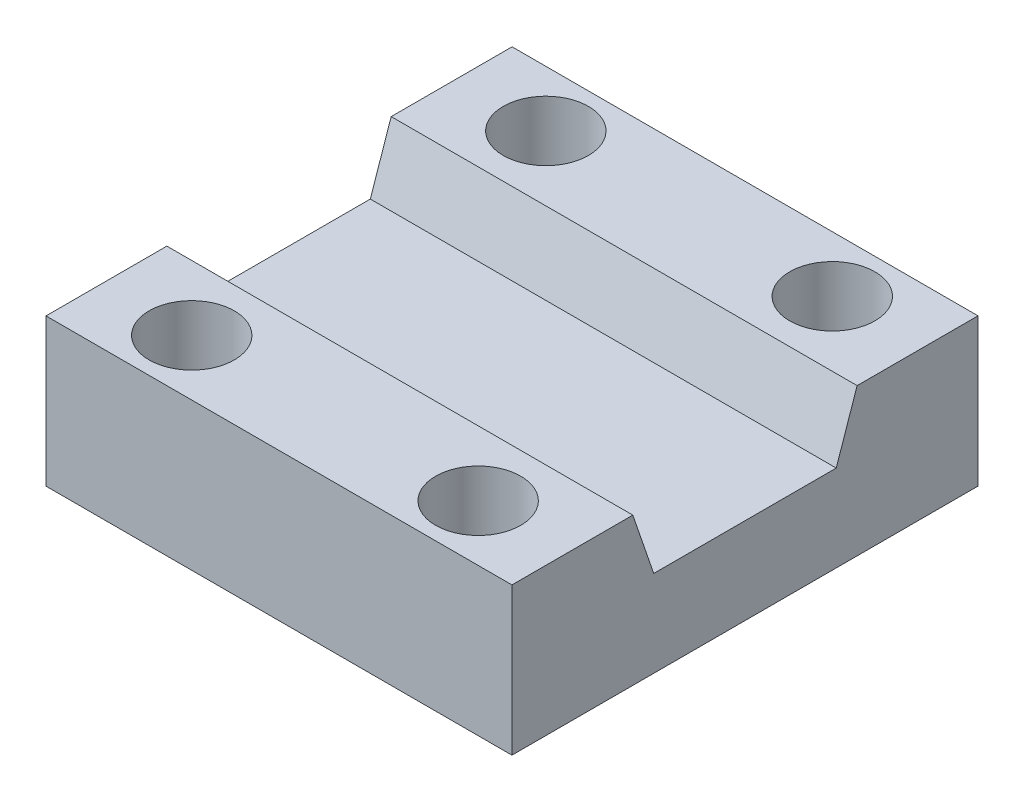
from build123d import *

# Parameters (mm, degrees)
SKETCH1_W                            = 38.29
SKETCH1_H                            = 38.3
BOSS_EXTRUDE1_DEPTH                  = 12.12
CUT_EXTRUDE1_DEPTH                   = 45.494280531
M8X1_0_TAPPED_HOLE2_D                = 7
MIRROR1_AT_THE_SECOND_PLANE_COPY_1_D = 7


with BuildPart() as part:
    # Sketch1 → Boss-Extrude1 (new body)
    with BuildSketch(Plane(origin=(0, 0, 0), x_dir=(1, 0, 0), z_dir=(0, 1, 0))):
        Rectangle(SKETCH1_W, SKETCH1_H)
    extrude(amount=BOSS_EXTRUDE1_DEPTH)

    # Sketch2 → Cut-Extrude1 (cut, through all)
    with BuildSketch(Plane(origin=(19.145, 0, 0), x_dir=(0, 0, -1), z_dir=(1, 0, 0))):
        with BuildLine():
            Line((8.348193896, 12.12), (-7.620525527, 12.12))
            ThreePointArc((-7.620525527, 12.12), (-7.350184436, 9.500113986), (-6.243729663, 7.11))
            Line((-6.243729663, 7.11), (6.971398032, 7.11))
            ThreePointArc((6.971398032, 7.11), (8.007802748, 9.259969363), (8.363834185, 11.62))
            ThreePointArc((8.363834185, 11.62), (8.359923156, 11.870122279), (8.348193896, 12.12))
        make_face()
        with BuildLine():
            Line((-7.620525527, 12.12), (-9.216421688, 12.12))
            Line((-9.216421688, 12.12), (-7.5, 7.11))
            Line((-7.5, 7.11), (-6.243729663, 7.11))
            ThreePointArc((-6.243729663, 7.11), (-7.350184436, 9.500113986), (-7.620525527, 12.12))
        make_face()
        with BuildLine():
            Line((9.216421688, 12.12), (8.348193896, 12.12))
            ThreePointArc((8.348193896, 12.12), (8.359923156, 11.870122279), (8.363834185, 11.62))
            ThreePointArc((8.363834185, 11.62), (8.007802748, 9.259969363), (6.971398032, 7.11))
            Line((6.971398032, 7.11), (7.5, 7.11))
            Line((7.5, 7.11), (9.216421688, 12.12))
        make_face()
    extrude(amount=-CUT_EXTRUDE1_DEPTH, mode=Mode.SUBTRACT)

    # M8x1.0 Tapped Hole2 (through all)
    with Locations(Plane(origin=(0, 12.12, 0), x_dir=(1, 0, 0), z_dir=(0, 1, 0))):
        with Locations((-11.77, 14.55), (11.77, 14.55), (-11.77, -14.55), (11.77, -14.55)):
            m8x1_0_tapped_hole2 = Hole(M8X1_0_TAPPED_HOLE2_D / 2)

    # Mirror1: M8x1.0 Tapped Hole2 across plane
    add(m8x1_0_tapped_hole2.mirror(Plane.XY), mode=Mode.SUBTRACT)

    # Mirror1 at the second plane: M8x1.0 Tapped Hole2 across plane
    add(m8x1_0_tapped_hole2.mirror(Plane(origin=(0, 0, 0), x_dir=(0, 0, 1), z_dir=(1, 0, 0))), mode=Mode.SUBTRACT)

    # Mirror1 at the second plane copy 1 (through all)
    with Locations(Plane(origin=(0, 12.12, 0), x_dir=(-1, 0, 0), z_dir=(0, 1, 0))):
        with Locations((-11.77, 14.55), (11.77, 14.55), (-11.77, -14.55), (11.77, -14.55)):
            Hole(MIRROR1_AT_THE_SECOND_PLANE_COPY_1_D / 2)


solid = part.part
